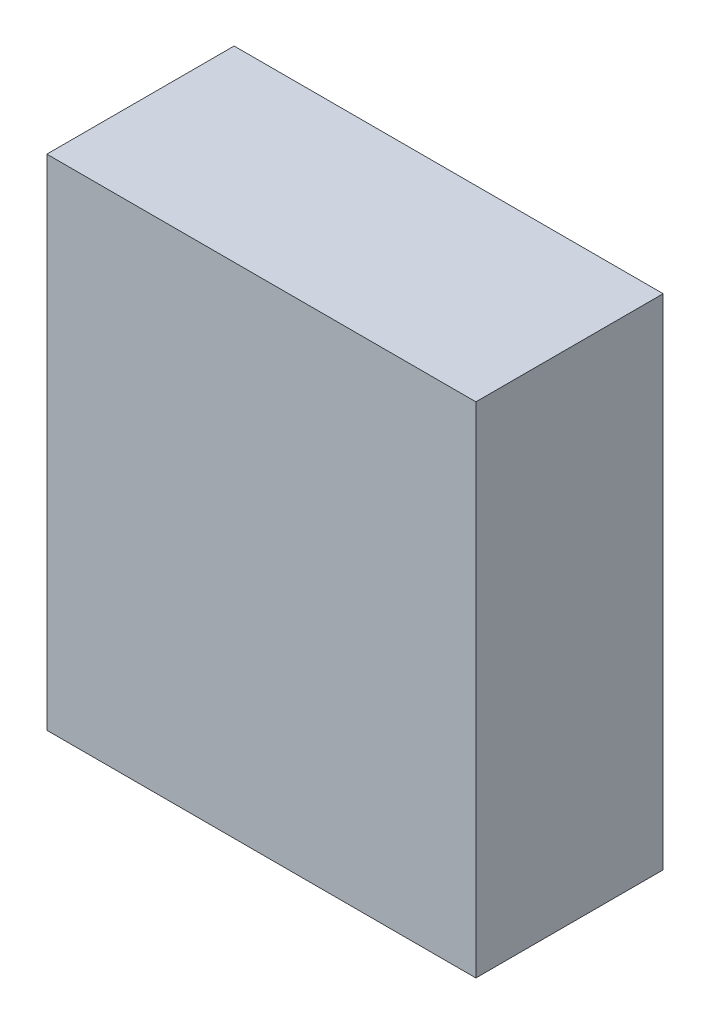
from build123d import *

# Parameters (mm, degrees)
SKETCH1_W           = 22.909803921
SKETCH1_H           = 26.64509804
BOSS_EXTRUDE1_DEPTH = 10


with BuildPart() as part:
    # Sketch1 → Boss-Extrude1 (new body)
    with BuildSketch(Plane.XY):
        with Locations((-31.718771157, 0)):
            Rectangle(SKETCH1_W, SKETCH1_H)
    extrude(amount=BOSS_EXTRUDE1_DEPTH)


solid = part.part
